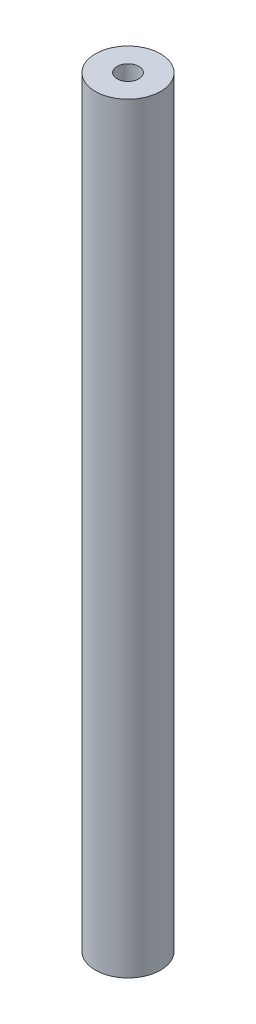
from build123d import *

# Parameters (mm, degrees)
CROQUIS3_R              = 3
CROQUIS3_R_2            = 1
SALIENTE_EXTRUIR2_DEPTH = 70


with BuildPart() as part:
    # Croquis3 → Saliente-Extruir2 (new body)
    with BuildSketch(Plane(origin=(0, 0, 0), x_dir=(1, 0, 0), z_dir=(0, 1, 0))):
        with Locations(Location((0, 8.285587056, 0), (0, 0, 270))):
            Circle(CROQUIS3_R)
        with Locations(Location((0, 8.285587056, 0), (0, 0, 270))):
            Circle(CROQUIS3_R_2, mode=Mode.SUBTRACT)
    extrude(amount=SALIENTE_EXTRUIR2_DEPTH)


solid = part.part
